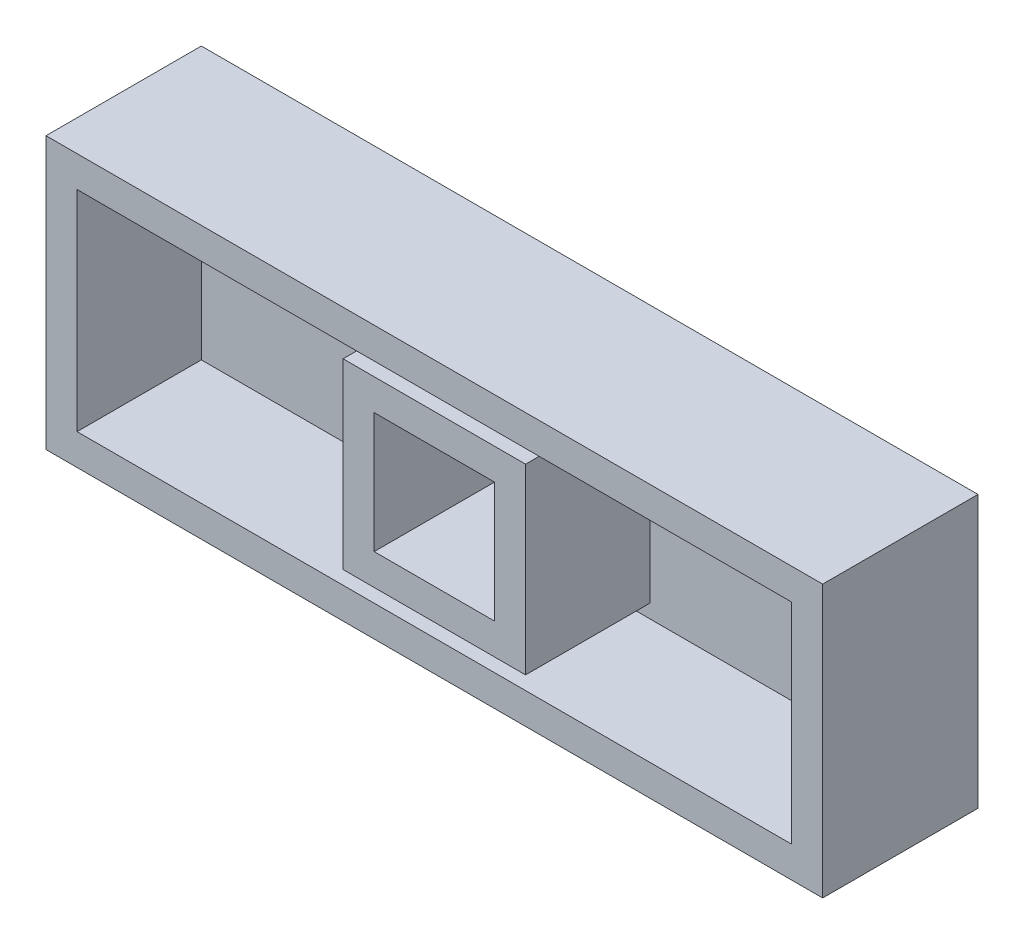
from build123d import *

# Parameters (mm, degrees)
SKETCH1_W           = 20
SKETCH1_H           = 7
SKETCH1_W_2         = 3.1
SKETCH1_H_2         = 3.1
BOSS_EXTRUDE1_DEPTH = 4
SHELL1_T            = -0.8


with BuildPart() as part:
    # Sketch1 → Boss-Extrude1 (new body)
    with BuildSketch(Plane.XY):
        with Locations((1.55, 1.55)):
            Rectangle(SKETCH1_W, SKETCH1_H)
        with Locations((1.55, 1.55)):
            Rectangle(SKETCH1_W_2, SKETCH1_H_2, mode=Mode.SUBTRACT)
    extrude(amount=BOSS_EXTRUDE1_DEPTH)

    # Shell1
    shell1_openings = [part.faces().sort_by_distance(p)[0] for p in [
        (1.55, -1.738103799, 4),
    ]]
    offset(amount=SHELL1_T, openings=shell1_openings, kind=Kind.INTERSECTION)


solid = part.part
